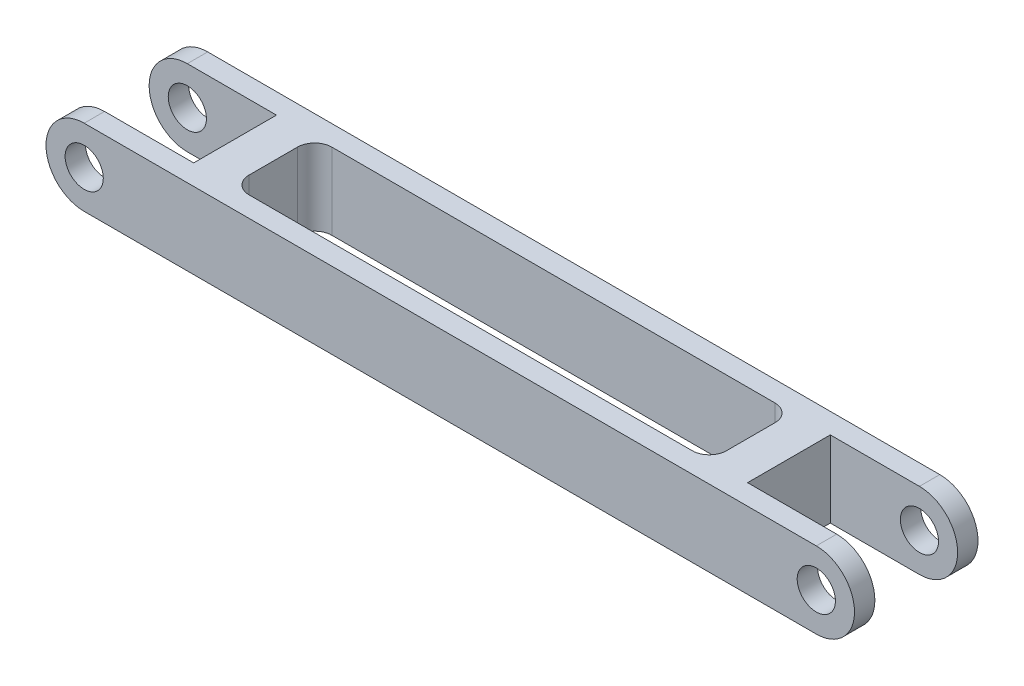
from build123d import *

# Parameters (mm, degrees)
SKETCH_1_R          = 3
EXTRUDE_1_DEPTH     = 19.4
SKETCH_2_W          = 20
SKETCH_2_H          = 13
CUT_EXTRUDE_1_DEPTH = 68.47303165


with BuildPart() as part:
    # 草图1 → 凸台-拉伸1 (new body)
    with BuildSketch(Plane.XY):
        with BuildLine():
            Line((-57.5, 6), (57.5, 6))
            ThreePointArc((57.5, 6), (63.5, 0), (57.5, -6))
            Line((57.5, -6), (-57.5, -6))
            ThreePointArc((-57.5, -6), (-63.5, 0), (-57.5, 6))
        make_face()
        with Locations((-57.5, 0)):
            Circle(SKETCH_1_R, mode=Mode.SUBTRACT)
        with Locations((57.5, 0)):
            Circle(SKETCH_1_R, mode=Mode.SUBTRACT)
    extrude(amount=EXTRUDE_1_DEPTH)

    # 草图2 → 切除-拉伸1 (cut, through all)
    with BuildSketch(Plane(origin=(0, 6, 0), x_dir=(1, 0, 0), z_dir=(0, 1, 0))):
        with Locations((-53.5, -9.7)):
            Rectangle(SKETCH_2_W, SKETCH_2_H)
        with Locations((53.5, -9.7)):
            Rectangle(SKETCH_2_W, SKETCH_2_H)
        with BuildLine():
            Line((-34.8, -3.2), (34.8, -3.2))
            ThreePointArc((34.8, -3.2), (36.709188309, -3.990811691), (37.5, -5.9))
            Line((37.5, -5.9), (37.5, -13.5))
            ThreePointArc((37.5, -13.5), (36.709188309, -15.409188309), (34.8, -16.2))
            Line((34.8, -16.2), (-34.8, -16.2))
            ThreePointArc((-34.8, -16.2), (-36.709188309, -15.409188309), (-37.5, -13.5))
            Line((-37.5, -13.5), (-37.5, -5.9))
            ThreePointArc((-37.5, -5.9), (-36.709188309, -3.990811691), (-34.8, -3.2))
        make_face()
    extrude(amount=-CUT_EXTRUDE_1_DEPTH, mode=Mode.SUBTRACT)


solid = part.part
